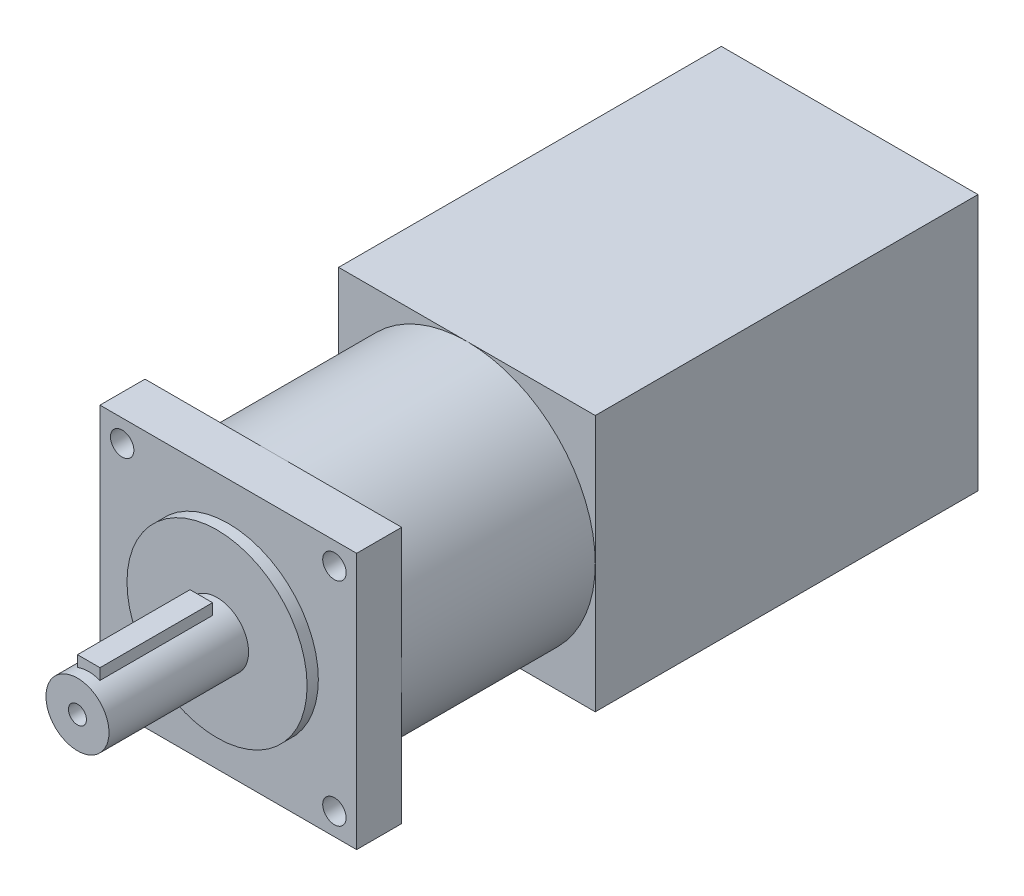
from build123d import *

# Parameters (mm, degrees)
SKETCH_1_W          = 57
SKETCH_1_H          = 57
EXTRUDE_1_DEPTH     = 85
SKETCH_2_R          = 28.5
EXTRUDE_2_DEPTH     = 53
SKETCH_3_R          = 20
EXTRUDE_3_DEPTH     = 2.5
SKETCH_4_R          = 7
EXTRUDE_4_DEPTH     = 31
SKETCH_7_W          = 57
SKETCH_7_H          = 57
SKETCH_7_R          = 2.6
EXTRUDE_5_DEPTH     = 10
SKETCH_8_W          = 5
SKETCH_8_H          = 4
EXTRUDE_6_DEPTH     = 25
SKETCH_9_R          = 2
CUT_EXTRUDE_1_DEPTH = 6


with BuildPart() as part:
    # 草图1 → 凸台-拉伸1 (new body)
    with BuildSketch(Plane.XY):
        Rectangle(SKETCH_1_W, SKETCH_1_H)
    extrude(amount=EXTRUDE_1_DEPTH)

    # 草图2 → 凸台-拉伸2 (add)
    with BuildSketch(Plane.XY.offset(85)):
        Circle(SKETCH_2_R)
    extrude(amount=EXTRUDE_2_DEPTH)

    # 草图3 → 凸台-拉伸3 (add)
    with BuildSketch(Plane.XY.offset(138)):
        Circle(SKETCH_3_R)
    extrude(amount=EXTRUDE_3_DEPTH)

    # 草图4 → 凸台-拉伸4 (add)
    with BuildSketch(Plane.XY.offset(140.5)):
        Circle(SKETCH_4_R)
    extrude(amount=EXTRUDE_4_DEPTH)

    # 草图7 → 凸台-拉伸5 (add)
    with BuildSketch(Plane.XY.offset(138)):
        Rectangle(SKETCH_7_W, SKETCH_7_H)
        with Locations((-23.57, 23.57)):
            Circle(SKETCH_7_R, mode=Mode.SUBTRACT)
        with Locations((23.57, 23.57)):
            Circle(SKETCH_7_R, mode=Mode.SUBTRACT)
        with Locations((23.57, -23.57)):
            Circle(SKETCH_7_R, mode=Mode.SUBTRACT)
        with Locations((-23.57, -23.57)):
            Circle(SKETCH_7_R, mode=Mode.SUBTRACT)
    extrude(amount=-EXTRUDE_5_DEPTH)

    # 草图8 → 凸台-拉伸6 (add)
    with BuildSketch(Plane.XY.offset(169)):
        with Locations((0, 7)):
            Rectangle(SKETCH_8_W, SKETCH_8_H)
    extrude(amount=-EXTRUDE_6_DEPTH)

    # 草图9 → 切除-拉伸1 (cut)
    with BuildSketch(Plane.XY.offset(171.5)):
        Circle(SKETCH_9_R)
    extrude(amount=-CUT_EXTRUDE_1_DEPTH, mode=Mode.SUBTRACT)


solid = part.part
